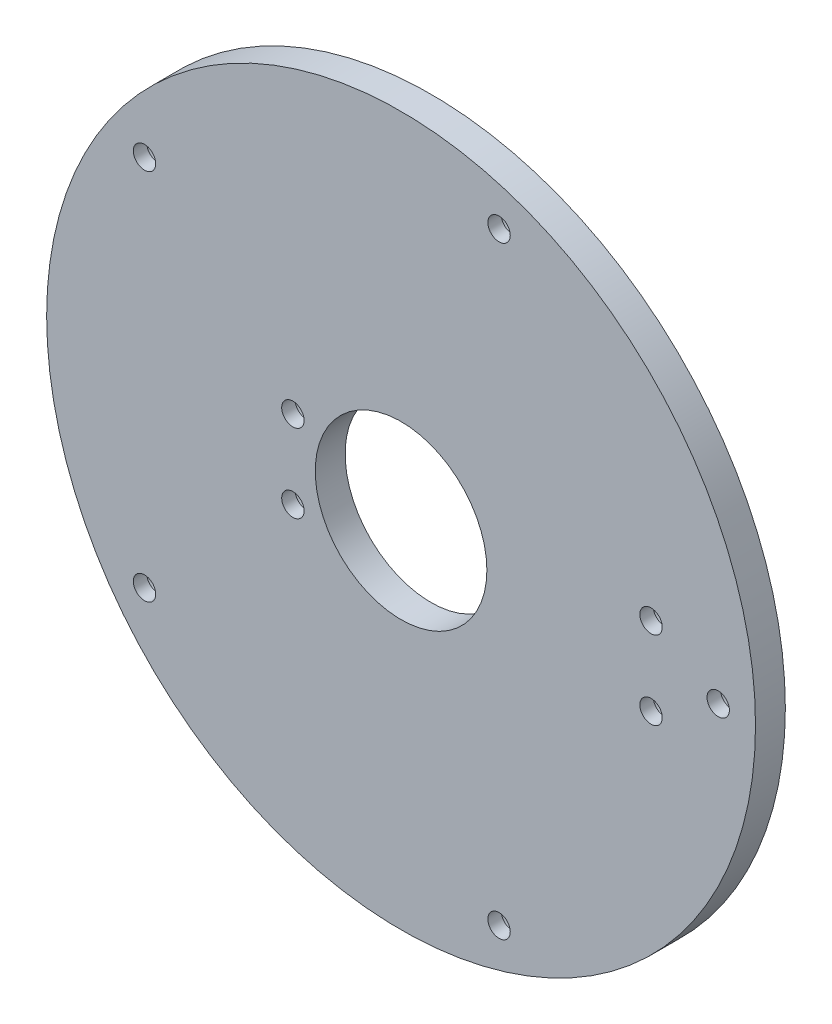
from build123d import *

# Parameters (mm, degrees)
SKETCH1_R           = 47.5
SKETCH1_R_2         = 11.5
SKETCH1_R_3         = 1.5
BOSS_EXTRUDE2_DEPTH = 4
SKETCH1_5_R         = 2.75
SKETCH1_5_R_2       = 1.5
CUT_EXTRUDE1_DEPTH  = 2.2


with BuildPart() as part:
    # Sketch1 → Boss-Extrude2 (new body)
    with BuildSketch(Plane.XY):
        with Locations((47.5, 47.5)):
            Circle(SKETCH1_R)
        with Locations((47.5, 47.5)):
            Circle(SKETCH1_R_2, mode=Mode.SUBTRACT)
        with Locations((13.116777739, 22.519126778)):
            Circle(SKETCH1_R_3, mode=Mode.SUBTRACT)
        with Locations((33, 42.125)):
            Circle(SKETCH1_R_3, mode=Mode.SUBTRACT)
        with Locations((60.633222261, 7.080098057)):
            Circle(SKETCH1_R_3, mode=Mode.SUBTRACT)
        with Locations((81, 42.125)):
            Circle(SKETCH1_R_3, mode=Mode.SUBTRACT)
        with Locations((33, 52.625)):
            Circle(SKETCH1_R_3, mode=Mode.SUBTRACT)
        with Locations((13.116777739, 72.480873222)):
            Circle(SKETCH1_R_3, mode=Mode.SUBTRACT)
        with Locations((81, 52.625)):
            Circle(SKETCH1_R_3, mode=Mode.SUBTRACT)
        with Locations((90, 47.5)):
            Circle(SKETCH1_R_3, mode=Mode.SUBTRACT)
        with Locations((60.633222261, 87.919901943)):
            Circle(SKETCH1_R_3, mode=Mode.SUBTRACT)
    extrude(amount=BOSS_EXTRUDE2_DEPTH)

    # Sketch1<5> → Cut-Extrude1 (cut)
    # profile 1 of 9: a face of its own
    with BuildSketch(Plane.XY):
        with Locations((13.116777739, 22.519126778)):
            Circle(SKETCH1_5_R)
        with Locations((13.116777739, 22.519126778)):
            Circle(SKETCH1_5_R_2, mode=Mode.SUBTRACT)
    # profile 2 of 9: a face of its own
    with BuildSketch(Plane.XY):
        with Locations((60.633222261, 7.080098057)):
            Circle(SKETCH1_5_R)
        with Locations((60.633222261, 7.080098057)):
            Circle(SKETCH1_5_R_2, mode=Mode.SUBTRACT)
    # profile 3 of 9: a face of its own
    with BuildSketch(Plane.XY):
        with Locations((33, 42.125)):
            Circle(SKETCH1_5_R)
        with Locations((33, 42.125)):
            Circle(SKETCH1_5_R_2, mode=Mode.SUBTRACT)
    # profile 4 of 9: a face of its own
    with BuildSketch(Plane.XY):
        with Locations((33, 52.625)):
            Circle(SKETCH1_5_R)
        with Locations((33, 52.625)):
            Circle(SKETCH1_5_R_2, mode=Mode.SUBTRACT)
    # profile 5 of 9: a face of its own
    with BuildSketch(Plane.XY):
        with Locations((13.116777739, 72.480873222)):
            Circle(SKETCH1_5_R)
        with Locations((13.116777739, 72.480873222)):
            Circle(SKETCH1_5_R_2, mode=Mode.SUBTRACT)
    # profile 6 of 9: a face of its own
    with BuildSketch(Plane.XY):
        with Locations((60.633222261, 87.919901943)):
            Circle(SKETCH1_5_R)
        with Locations((60.633222261, 87.919901943)):
            Circle(SKETCH1_5_R_2, mode=Mode.SUBTRACT)
    # profile 7 of 9: a face of its own
    with BuildSketch(Plane.XY):
        with Locations((81, 52.625)):
            Circle(SKETCH1_5_R)
        with Locations((81, 52.625)):
            Circle(SKETCH1_5_R_2, mode=Mode.SUBTRACT)
    # profile 8 of 9: a face of its own
    with BuildSketch(Plane.XY):
        with Locations((90, 47.5)):
            Circle(SKETCH1_5_R)
        with Locations((90, 47.5)):
            Circle(SKETCH1_5_R_2, mode=Mode.SUBTRACT)
    # profile 9 of 9: a face of its own
    with BuildSketch(Plane.XY):
        with Locations((81, 42.125)):
            Circle(SKETCH1_5_R)
        with Locations((81, 42.125)):
            Circle(SKETCH1_5_R_2, mode=Mode.SUBTRACT)
    extrude(amount=CUT_EXTRUDE1_DEPTH, mode=Mode.SUBTRACT)


solid = part.part
